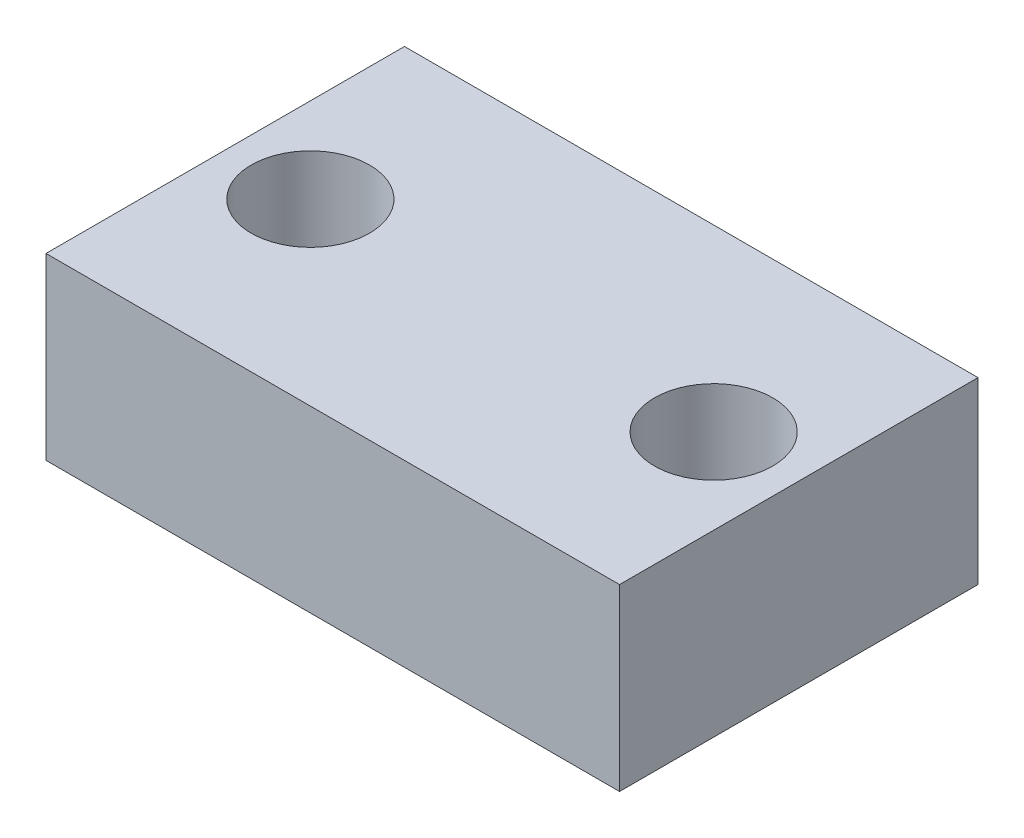
from build123d import *

# Parameters (mm, degrees)
CROQUIS1_W              = 16
CROQUIS1_H              = 10
SALIENTE_EXTRUIR1_DEPTH = 5
CORTAR_EXTRUIR1_REACH   = 12.677
CROQUIS2_R              = 1.65


with BuildPart() as part:
    # Croquis1 → Saliente-Extruir1 (new body)
    with BuildSketch(Plane(origin=(0, 0, 0), x_dir=(1, 0, 0), z_dir=(0, 1, 0))):
        Rectangle(CROQUIS1_W, CROQUIS1_H)
    extrude(amount=SALIENTE_EXTRUIR1_DEPTH)

    # Croquis2 → Cortar-Extruir1 (cut, up to next)
    with BuildSketch(Plane.XZ, mode=Mode.PRIVATE) as cortar_extruir1_sk1:
        with Locations(Location((-5.625, 0, 0), (0, 0, 270))):
            Circle(CROQUIS2_R)
    cortar_extruir1_tool1 = extrude(cortar_extruir1_sk1.sketch, amount=-CORTAR_EXTRUIR1_REACH, mode=Mode.PRIVATE) & part.part
    # Croquis2 → Cortar-Extruir1 (cut, up to next)
    with BuildSketch(Plane.XZ, mode=Mode.PRIVATE) as cortar_extruir1_sk2:
        with Locations(Location((5.625, 0, 0), (0, 0, 270))):
            Circle(CROQUIS2_R)
    cortar_extruir1_tool2 = extrude(cortar_extruir1_sk2.sketch, amount=-CORTAR_EXTRUIR1_REACH, mode=Mode.PRIVATE) & part.part
    add(cortar_extruir1_tool1.solids().sort_by_distance((-5.625, 0, 0))[0], mode=Mode.SUBTRACT)
    add(cortar_extruir1_tool2.solids().sort_by_distance((5.625, 0, 0))[0], mode=Mode.SUBTRACT)


solid = part.part
